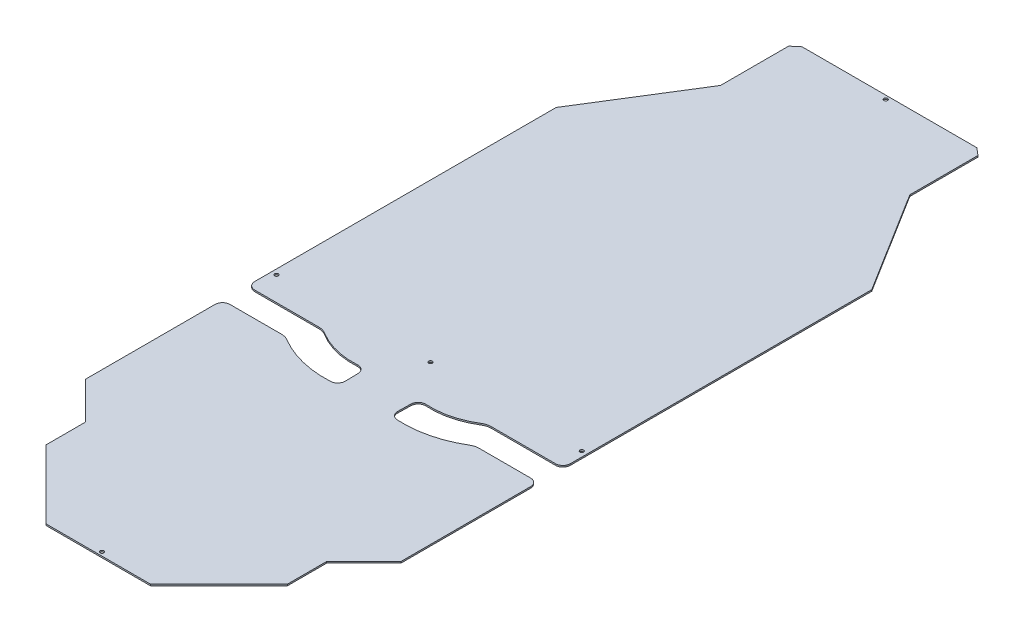
from build123d import *

# Parameters (mm, degrees)
SKETCH1_R           = 1.25
BOSS_EXTRUDE1_DEPTH = 1


with BuildPart() as part:
    # Sketch1 → Boss-Extrude1 (new body)
    with BuildSketch(Plane(origin=(0, 0, 0), x_dir=(1, 0, 0), z_dir=(0, 1, 0))):
        with BuildLine():
            Line((-35.214466094, -273.75), (35.214466094, -273.75))
            Line((35.214466094, -273.75), (81.25, -227.714466094))
            Line((81.25, -227.714466094), (81.25, -201.25))
            Line((81.25, -201.25), (106.25, -176.25))
            Line((106.25, -176.25), (106.25, -88.874002831))
            ThreePointArc((106.25, -88.874002831), (104.785533906, -85.338468925), (101.25, -83.874002831))
            Line((101.25, -83.874002831), (66.605380572, -83.874002831))
            ThreePointArc((66.605380572, -83.874002831), (63.947538367, -84.23367738), (61.480887801, -85.286827869))
            ThreePointArc((61.480887801, -85.286827869), (42.637913048, -93.018246989), (22.356633062, -94.889669244))
            ThreePointArc((22.356633062, -94.889669244), (18.9756934, -93.299812922), (17.640548545, -89.810431267))
            Line((17.640548545, -89.810431267), (17.793393264, -81.053963175))
            ThreePointArc((17.793393264, -81.053963175), (19.401963586, -77.466532095), (23.106937946, -76.151113824))
            ThreePointArc((23.106937946, -76.151113824), (38.512493282, -74.722995147), (52.743936183, -68.653671368))
            ThreePointArc((52.743936183, -68.653671368), (55.286579623, -67.521722803), (58.04272342, -67.134405642))
            Line((58.04272342, -67.134405642), (101.25, -67.134405642))
            ThreePointArc((101.25, -67.134405642), (104.785533906, -65.669939548), (106.25, -62.134405642))
            Line((106.25, -62.134405642), (106.25, 140.817393532))
            Line((106.25, 140.817393532), (63.754385783, 208.997474683))
            Line((63.754385783, 208.997474683), (63.754385783, 254.885164258))
            Line((63.754385783, 254.885164258), (58.833815977, 258.997474683))
            Line((58.833815977, 258.997474683), (-58.833815977, 258.997474683))
            Line((-58.833815977, 258.997474683), (-63.754385783, 254.885164258))
            Line((-63.754385783, 254.885164258), (-63.754385783, 208.997474683))
            Line((-63.754385783, 208.997474683), (-106.25, 140.817393532))
            Line((-106.25, 140.817393532), (-106.25, -62.134405642))
            ThreePointArc((-106.25, -62.134405642), (-104.785533906, -65.669939548), (-101.25, -67.134405642))
            Line((-101.25, -67.134405642), (-58.04272342, -67.134405642))
            ThreePointArc((-58.04272342, -67.134405642), (-55.286579623, -67.521722803), (-52.743936183, -68.653671368))
            ThreePointArc((-52.743936183, -68.653671368), (-38.512493282, -74.722995147), (-23.106937946, -76.151113824))
            ThreePointArc((-23.106937946, -76.151113824), (-19.401963586, -77.466532095), (-17.793393264, -81.053963175))
            Line((-17.793393264, -81.053963175), (-17.640548545, -89.810431267))
            ThreePointArc((-17.640548545, -89.810431267), (-18.9756934, -93.299812922), (-22.356633062, -94.889669244))
            ThreePointArc((-22.356633062, -94.889669244), (-42.637913048, -93.018246989), (-61.480887801, -85.286827869))
            ThreePointArc((-61.480887801, -85.286827869), (-63.947538367, -84.23367738), (-66.605380572, -83.874002831))
            Line((-66.605380572, -83.874002831), (-101.25, -83.874002831))
            ThreePointArc((-101.25, -83.874002831), (-104.785533906, -85.338468925), (-106.25, -88.874002831))
            Line((-106.25, -88.874002831), (-106.25, -176.25))
            Line((-106.25, -176.25), (-81.25, -201.25))
            Line((-81.25, -201.25), (-81.25, -227.714466094))
            Line((-81.25, -227.714466094), (-35.214466094, -273.75))
        make_face()
        with Locations((0, 256.50465463)):
            Circle(SKETCH1_R, mode=Mode.SUBTRACT)
        with Locations((-102.8125, -50.9375)):
            Circle(SKETCH1_R, mode=Mode.SUBTRACT)
        with Locations((0, -50)):
            Circle(SKETCH1_R, mode=Mode.SUBTRACT)
        with Locations((0, -271.25)):
            Circle(SKETCH1_R, mode=Mode.SUBTRACT)
        with Locations((102.8125, -50.9375)):
            Circle(SKETCH1_R, mode=Mode.SUBTRACT)
    extrude(amount=BOSS_EXTRUDE1_DEPTH)


solid = part.part
